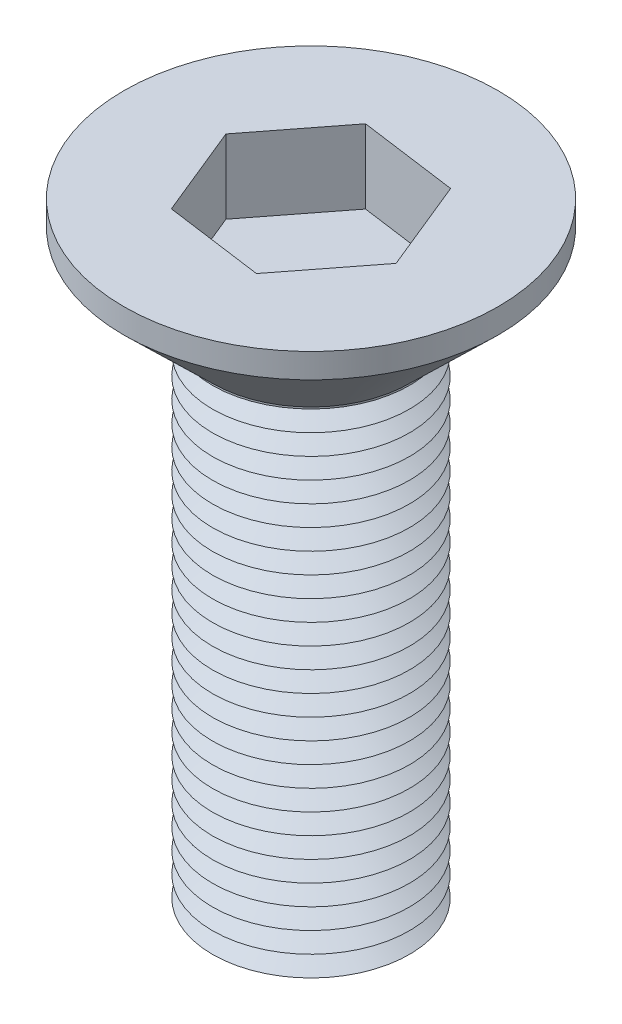
from build123d import *

# Parameters (mm, degrees)
CUT_EXTRUDE_1_DEPTH = 3


with BuildPart() as part:
    # 草图1 → 旋转1 (revolve)
    with BuildSketch(Plane.XY, mode=Mode.PRIVATE) as revolve_1_sk:
        Polygon((7.6, 25), (0, 25), (0, 0), (3.3, 0), (4, 0.416910771), (3.3, 0.833821542), (4, 1.250732313), (3.3, 1.667643084), (4, 2.084553856), (3.3, 2.501464627), (4, 2.918375398), (3.3, 3.335286169), (4, 3.75219694), (3.3, 4.169107711), (4, 4.586018482), (3.3, 5.002929253), (4, 5.419840024), (3.3, 5.836750796), (4, 6.253661567), (3.3, 6.670572338), (4, 7.087483109), (3.3, 7.50439388), (4, 7.921304651), (3.3, 8.338215422), (4, 8.755126193), (3.3, 9.172036964), (4, 9.588947736), (3.3, 10.005858507), (4, 10.422769278), (3.3, 10.839680049), (4, 11.25659082), (3.3, 11.673501591), (4, 12.090412362), (3.3, 12.507323133), (4, 12.924233904), (3.3, 13.341144675), (4, 13.758055447), (3.3, 14.174966218), (4, 14.591876989), (3.3, 15.00878776), (4, 15.425698531), (3.3, 15.842609302), (4, 16.259520073), (3.3, 16.676430844), (4, 17.093341615), (3.3, 17.510252387), (4, 17.927163158), (3.3, 18.344073929), (4, 18.7609847), (3.3, 19.177895471), (4, 19.594806242), (3.3, 20.011717013), (4, 20.428627784), (4, 20.5), (7.6, 24), align=None)
    revolve(revolve_1_sk.sketch.rotate(Axis((0, 20.5, 0), (0, 1, 0)), 270), axis=Axis((0, 20.5, 0), (0, 1, 0)))

    # 草图3 → 切除-拉伸1 (cut)
    with BuildSketch(Plane(origin=(0, 25, 0), x_dir=(1, 0, 0), z_dir=(0, 1, 0))):
        Polygon((4.003980009, -0.549069595), (2.477498223, 3.193013606), (-1.526481787, 3.742083202), (-4.003980009, 0.549069595), (-2.477498223, -3.193013606), (1.526481787, -3.742083202), align=None)
    extrude(amount=-CUT_EXTRUDE_1_DEPTH, mode=Mode.SUBTRACT)


solid = part.part
